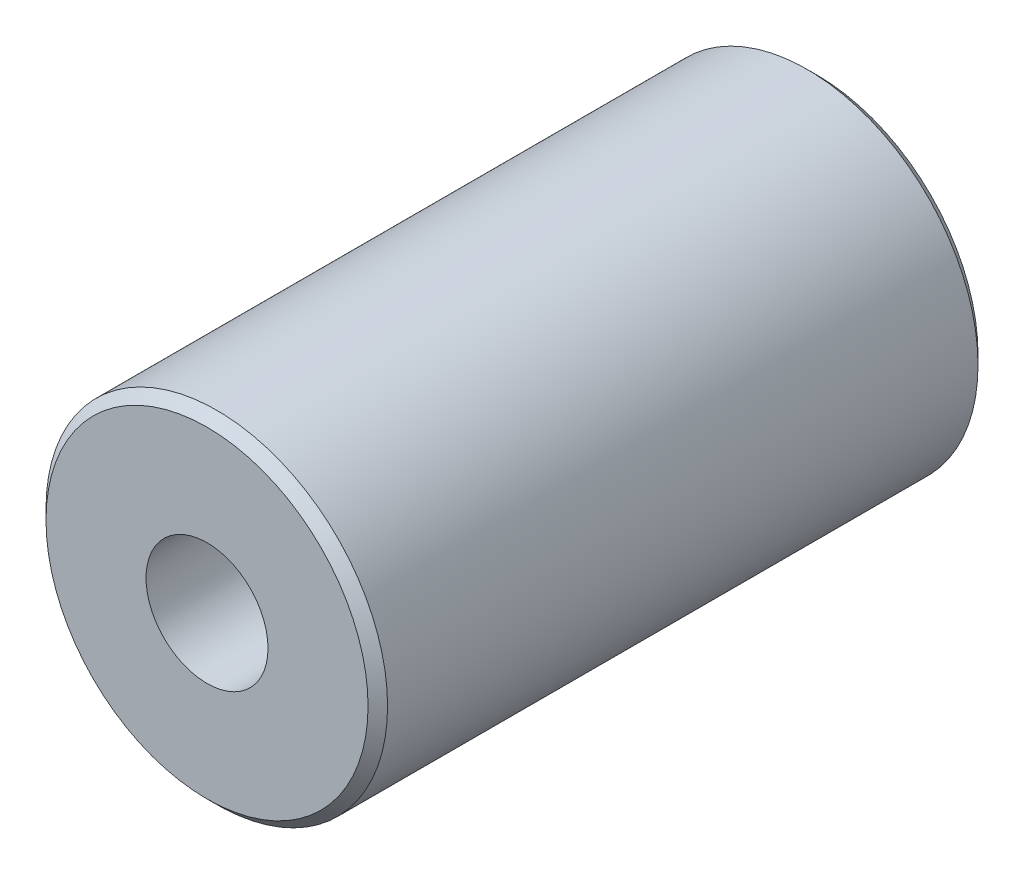
from build123d import *

# Parameters (mm, degrees)
SKETCH1_R           = 7
BOSS_EXTRUDE1_DEPTH = 12.5
SKETCH2_R           = 2.5
CUT_EXTRUDE1_DEPTH  = 27.888659319
SKETCH3_R           = 4
CUT_EXTRUDE2_DEPTH  = 16.945218719
CHAMFER1_SIZE       = 0.4


with BuildPart() as part:
    # Sketch1 → Boss-Extrude1 (new, symmetric)
    with BuildSketch(Plane.XY):
        Circle(SKETCH1_R)
    extrude(amount=BOSS_EXTRUDE1_DEPTH, both=True)

    # Sketch2 → Cut-Extrude1 (cut, through all)
    with BuildSketch(Plane.XY.offset(12.5)):
        Circle(SKETCH2_R)
    extrude(amount=-CUT_EXTRUDE1_DEPTH, mode=Mode.SUBTRACT)

    # Sketch3 → Cut-Extrude2 (cut, through all)
    with BuildSketch(Plane.XY):
        Circle(SKETCH3_R)
    extrude(amount=-CUT_EXTRUDE2_DEPTH, mode=Mode.SUBTRACT)

    # Chamfer1
    chamfer1_edges = [part.edges().sort_by_distance(p)[0] for p in [
        (-7, 0, -12.5),
        (-7, 0, 12.5),
    ]]
    chamfer(chamfer1_edges, length=CHAMFER1_SIZE)


solid = part.part
